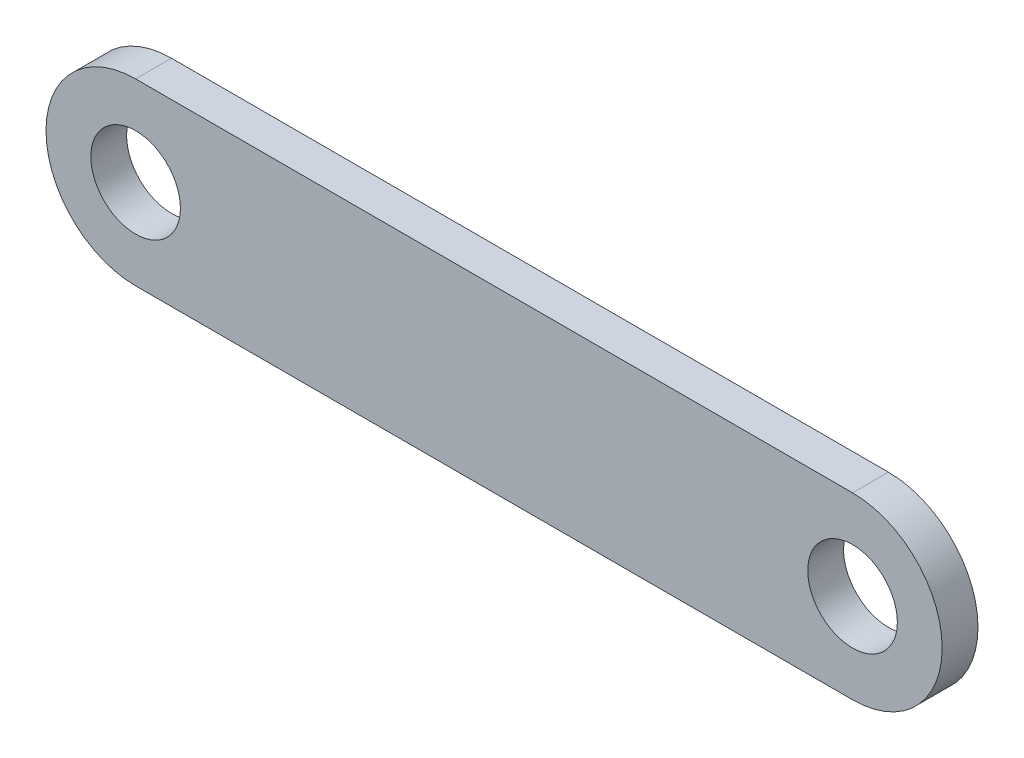
from build123d import *

# Parameters (mm, degrees)
ESQUISSE1_R          = 5
BASE_EXTRUSION_DEPTH = 2


with BuildPart() as part:
    # Esquisse1 → Base-Extrusion (new, symmetric)
    with BuildSketch(Plane.XY):
        with BuildLine():
            Line((0, 10), (80, 10))
            ThreePointArc((80, 10), (90, 0), (80, -10))
            Line((80, -10), (0, -10))
            ThreePointArc((0, -10), (-10, 0), (0, 10))
        make_face()
        Circle(ESQUISSE1_R, mode=Mode.SUBTRACT)
        with Locations((80, 0)):
            Circle(ESQUISSE1_R, mode=Mode.SUBTRACT)
    extrude(amount=BASE_EXTRUSION_DEPTH, both=True)


solid = part.part
